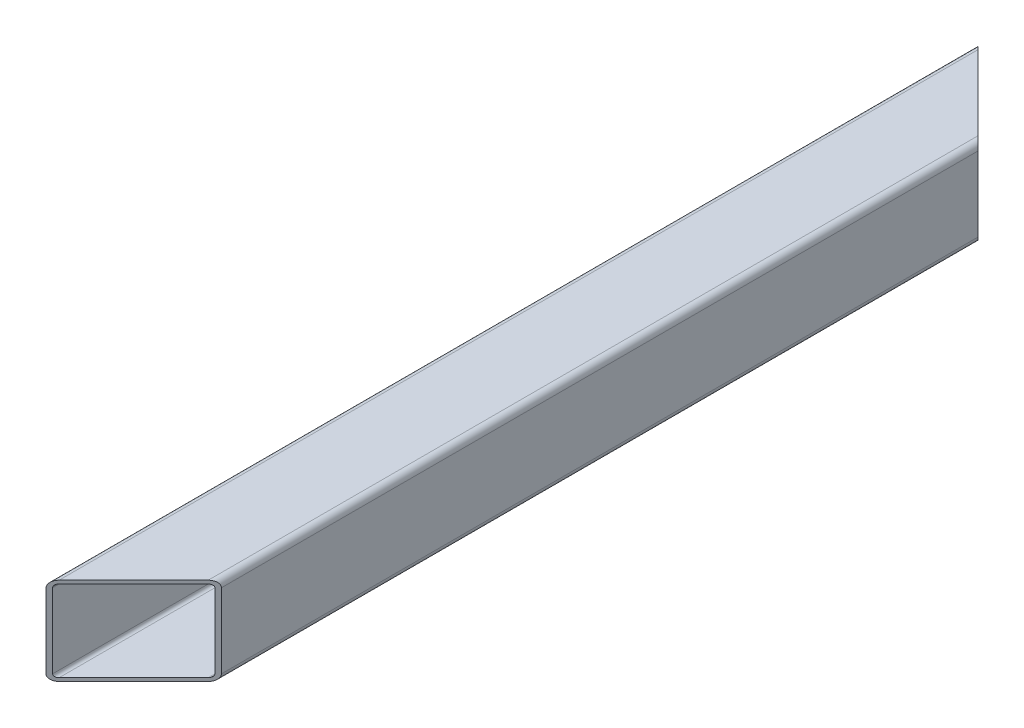
from build123d import *

# Parameters (mm, degrees)
AUFSATZ_LINEAR_AUSTRAGEN1_DEPTH = 425
SCHNITT_LINEAR_AUSTRAGEN1_DEPTH = 140


with BuildPart() as part:
    # Skizze1 → Aufsatz-Linear austragen1 (new, symmetric)
    with BuildSketch(Plane.XY):
        with BuildLine():
            Line((-34, 40), (34, 40))
            ThreePointArc((34, 40), (38.242640687, 38.242640687), (40, 34))
            Line((40, 34), (40, -34))
            ThreePointArc((40, -34), (38.242640687, -38.242640687), (34, -40))
            Line((34, -40), (-34, -40))
            ThreePointArc((-34, -40), (-38.242640687, -38.242640687), (-40, -34))
            Line((-40, -34), (-40, 34))
            ThreePointArc((-40, 34), (-38.242640687, 38.242640687), (-34, 40))
        make_face()
        with BuildLine():
            Line((-37, 34), (-37, -34))
            ThreePointArc((-37, -34), (-36.121320344, -36.121320344), (-34, -37))
            Line((-34, -37), (34, -37))
            ThreePointArc((34, -37), (36.121320344, -36.121320344), (37, -34))
            Line((37, -34), (37, 34))
            ThreePointArc((37, 34), (36.121320344, 36.121320344), (34, 37))
            Line((34, 37), (-34, 37))
            ThreePointArc((-34, 37), (-36.121320344, 36.121320344), (-37, 34))
        make_face(mode=Mode.SUBTRACT)
    extrude(amount=AUFSATZ_LINEAR_AUSTRAGEN1_DEPTH, both=True)

    # Skizze2 → Schnitt-Linear austragen1 (cut)
    with BuildSketch(Plane(origin=(0, 40, 0), x_dir=(1, 0, 0), z_dir=(0, 1, 0))):
        Polygon((-40, 425), (40, 425), (40, 345), align=None)
        Polygon((40, -345), (-40, -425), (40, -425), align=None)
    extrude(amount=-SCHNITT_LINEAR_AUSTRAGEN1_DEPTH, mode=Mode.SUBTRACT)


solid = part.part
